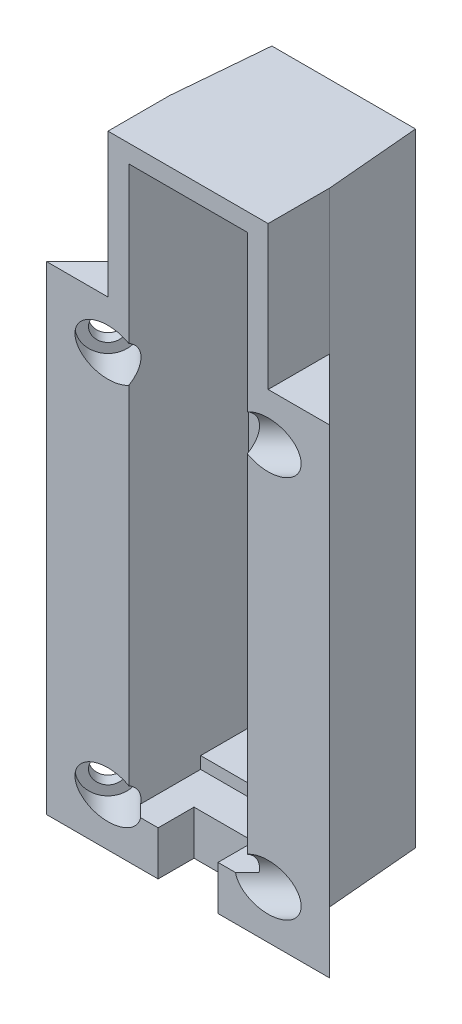
from build123d import *

# Parameters (mm, degrees)
EXTRUDE_1_DEPTH     = 40
EXTRUDE_2_DEPTH     = 12
SKETCH_3_W          = 9.9
SKETCH_3_H          = 45.3
CUT_EXTRUDE_1_DEPTH = 10
SKETCH_4_W          = 3.5
SKETCH_4_H          = 35
CUT_EXTRUDE_2_DEPTH = 55.257079031
SKETCH_5_W          = 9.9
SKETCH_5_H          = 0.5
SKETCH_5_H_2        = 1
CUT_EXTRUDE_3_DEPTH = 6
SKETCH_6_R          = 1.15
CUT_EXTRUDE_4_DEPTH = 55.257079031
SKETCH_7_R          = 1.95
CUT_EXTRUDE_5_DEPTH = 1.2
SKETCH_10_R         = 1.15
CUT_EXTRUDE_6_DEPTH = 10
CUT_EXTRUDE_START   = -1
SKETCH_11_R         = 1.95
CUT_EXTRUDE_7_DEPTH = 10
SKETCH_12_W         = 5
SKETCH_12_H         = 3
CUT_EXTRUDE_8_DEPTH = 52.397671397


with BuildPart() as part:
    # 草图1 → 凸台-拉伸1 (new body)
    with BuildSketch(Plane(origin=(0, 0, 0), x_dir=(1, 0, 0), z_dir=(0, 1, 0))):
        Polygon((6.687916013, 5.137083987), (6, 13), (-6, 13), (-6.687916013, 5.137083987), (-11.825, 0), (11.825, 0), align=None)
    extrude(amount=EXTRUDE_1_DEPTH)

    # 草图2 → 凸台-拉伸2 (add)
    with BuildSketch(Plane(origin=(0, 40, 0), x_dir=(1, 0, 0), z_dir=(0, 1, 0))):
        Polygon((6.687916013, 5.137083987), (6, 13), (-6, 13), (-6.687916013, 5.137083987), (-6.687916013, 0), (6.687916013, 0), align=None)
    extrude(amount=EXTRUDE_2_DEPTH)

    # 草图3 → 切除-拉伸1 (cut)
    with BuildSketch(Plane.XY):
        with Locations((0, 27.35)):
            Rectangle(SKETCH_3_W, SKETCH_3_H)
    extrude(amount=-CUT_EXTRUDE_1_DEPTH, mode=Mode.SUBTRACT)

    # 草图4 → 切除-拉伸2 (cut, through all)
    with BuildSketch(Plane.XY.offset(-10)):
        with Locations((0, 27.35)):
            Rectangle(SKETCH_4_W, SKETCH_4_H)
    extrude(amount=-CUT_EXTRUDE_2_DEPTH, mode=Mode.SUBTRACT)

    # 草图5 → 切除-拉伸3 (cut)
    with BuildSketch(Plane.XY):
        with Locations((0, 50.25)):
            Rectangle(SKETCH_5_W, SKETCH_5_H)
        with Locations((0, 4.2)):
            Rectangle(SKETCH_5_W, SKETCH_5_H_2)
    extrude(amount=-CUT_EXTRUDE_3_DEPTH, mode=Mode.SUBTRACT)

    # 草图6 → 切除-拉伸4 (cut, through all)
    with BuildSketch(Plane.XY.offset(-10)):
        with Locations((0, 47.85)):
            Circle(SKETCH_6_R)
        with Locations(Location((0, 6.85, 0), (0, 0, 180))):
            Circle(SKETCH_6_R)
    extrude(amount=-CUT_EXTRUDE_4_DEPTH, mode=Mode.SUBTRACT)

    # 草图7 → 切除-拉伸5 (cut)
    with BuildSketch(Plane(origin=(0, 0, -13), x_dir=(-1, 0, 0), z_dir=(0, 0, -1))):
        with Locations((0, 47.85)):
            Circle(SKETCH_7_R)
        with Locations((0, 6.85)):
            Circle(SKETCH_7_R)
    extrude(amount=-CUT_EXTRUDE_5_DEPTH, mode=Mode.SUBTRACT)

    # 草图10 → 切除-拉伸6 (cut)
    with BuildSketch(Plane(origin=(-5.9125, 0, -5.9125), x_dir=(-0.7071067811865515, 0, 0.7071067811865437), z_dir=(-0.7071067811865437, 0, -0.7071067811865515))):
        with Locations((4.729070765, 36)):
            Circle(SKETCH_10_R)
        with Locations((4.729070765, 4)):
            Circle(SKETCH_10_R)
    cut_extrude_6 = extrude(amount=-CUT_EXTRUDE_6_DEPTH, mode=Mode.SUBTRACT)

    # 草图11 → 切除-拉伸7 (cut)
    with BuildSketch(Plane(origin=(-5.9125, 0, -5.9125), x_dir=(-0.7071067811865515, 0, 0.7071067811865437), z_dir=(-0.7071067811865437, 0, -0.7071067811865515)).offset(CUT_EXTRUDE_START)):
        with Locations((4.729070765, 36)):
            Circle(SKETCH_11_R)
        with Locations((4.729070765, 4)):
            Circle(SKETCH_11_R)
    cut_extrude_7 = extrude(amount=-CUT_EXTRUDE_7_DEPTH, mode=Mode.SUBTRACT)

    # 镜向1: 切除-拉伸6, 切除-拉伸7 across plane
    add(cut_extrude_6.mirror(Plane(origin=(0, 0, 0), x_dir=(0, 0, 1), z_dir=(1, 0, 0))), mode=Mode.SUBTRACT)
    add(cut_extrude_7.mirror(Plane(origin=(0, 0, 0), x_dir=(0, 0, 1), z_dir=(1, 0, 0))), mode=Mode.SUBTRACT)

    # 草图12 → 切除-拉伸8 (cut, through all)
    with BuildSketch(Plane(origin=(0, 3.7, 0), x_dir=(1, 0, 0), z_dir=(0, 1, 0))):
        with Locations((0, 1.5)):
            Rectangle(SKETCH_12_W, SKETCH_12_H)
    extrude(amount=-CUT_EXTRUDE_8_DEPTH, mode=Mode.SUBTRACT)


solid = part.part
